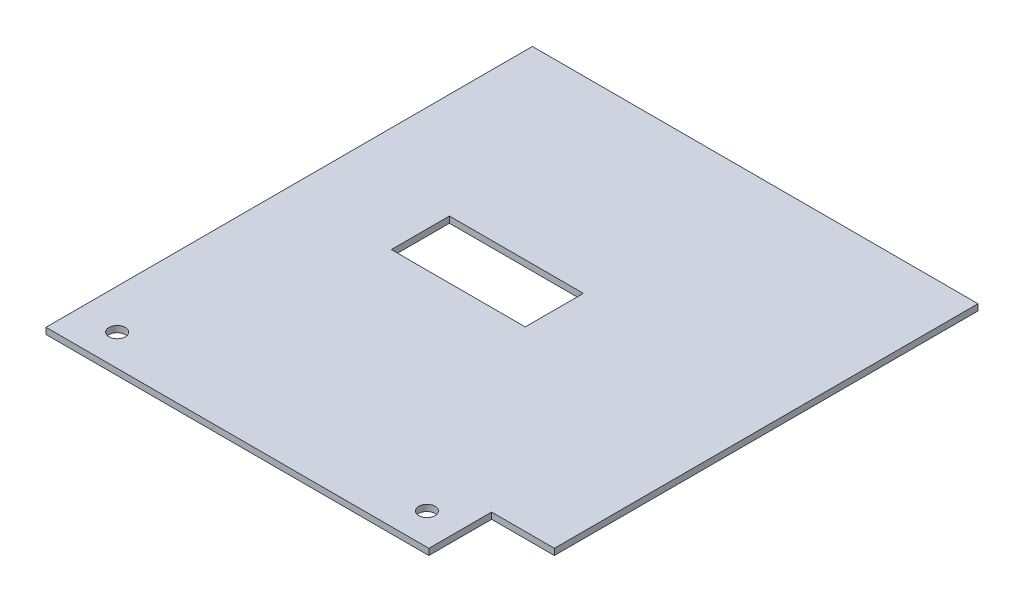
from build123d import *

# Parameters (mm, degrees)
P_IDAT_VYSUNUT_M1_DEPTH  = 2
SKICA2_W                 = 42.685297449
SKICA2_H                 = 18.521827687
ODEBRAT_VYSUNUT_M1_DEPTH = 2
SKICA3_R                 = 2.6
ODEBRAT_VYSUNUT_M2_DEPTH = 2


with BuildPart() as part:
    # Skica1 → Přidat vysunutím1 (new body)
    with BuildSketch(Plane(origin=(0, 0, 0), x_dir=(1, 0, 0), z_dir=(0, 1, 0))):
        Polygon((51.954387959, -76.458238495), (-70.045612041, -76.458238495), (-70.045612041, 78.541761505), (71.954387959, 78.541761505), (71.954387959, -56.458238495), (51.954387959, -56.458238495), align=None)
    extrude(amount=P_IDAT_VYSUNUT_M1_DEPTH)

    # Skica2 → Odebrat vysunutím1 (cut)
    with BuildSketch(Plane(origin=(0, 2, 0), x_dir=(1, 0, 0), z_dir=(0, 1, 0))):
        with Locations((-15.127554213, 9.260913844)):
            Rectangle(SKICA2_W, SKICA2_H)
    extrude(amount=-ODEBRAT_VYSUNUT_M1_DEPTH, mode=Mode.SUBTRACT)

    # Skica3 → Odebrat vysunutím2 (cut)
    with BuildSketch(Plane.XZ):
        with Locations(Location((41.337845964, 66.458238495, 0), (0, 0, 270))):
            Circle(SKICA3_R)
        with Locations(Location((-57.3704334, 66.458238495, 0), (0, 0, 270))):
            Circle(SKICA3_R)
    extrude(amount=-ODEBRAT_VYSUNUT_M2_DEPTH, mode=Mode.SUBTRACT)


solid = part.part
